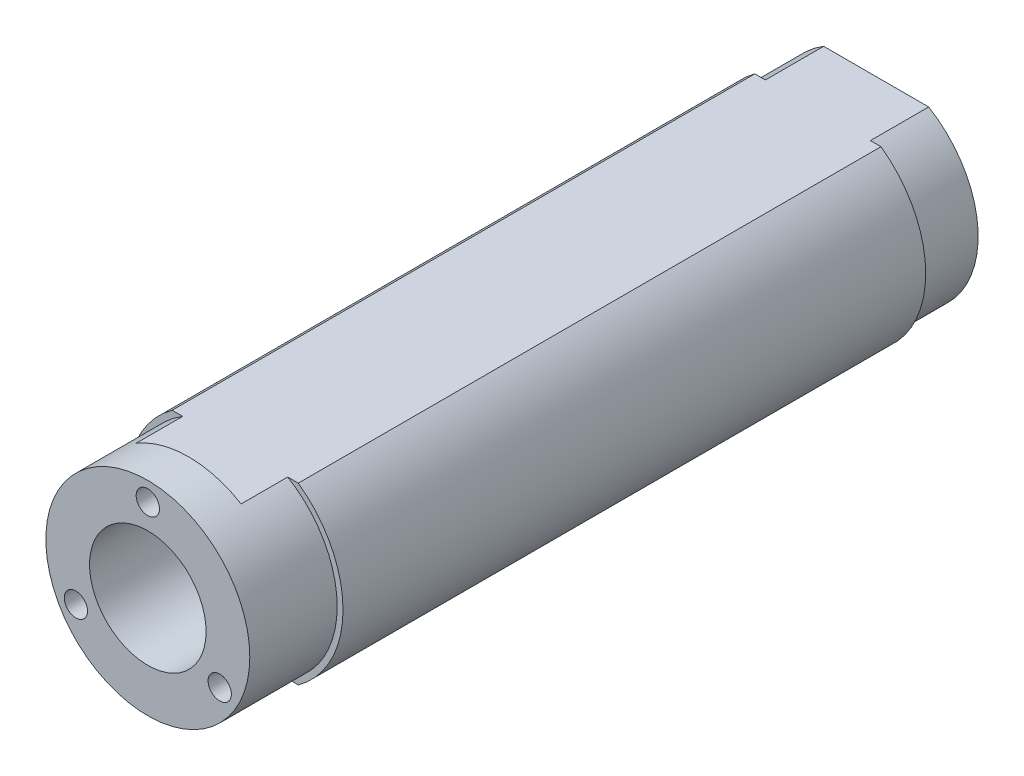
from build123d import *

# Parameters (mm, degrees)
BOSS_EXTRUDE1_DEPTH         = 65
BOSS_EXTRUDE1_DEPTH_BACK    = 60
SKETCH1_R                   = 10
BOSS_EXTRUDE2_DEPTH         = 50
BOSS_EXTRUDE2_DEPTH_BACK    = 50
BOSS_EXTRUDE3_START         = -7
SKETCH5_R                   = 17.5
SKETCH5_R_2                 = 10
BOSS_EXTRUDE3_DEPTH         = 7
SKETCH6_R                   = 2
CUT_EXTRUDE1_DEPTH          = 5
M3_TAPPED_HOLE1_D           = 2.5
M3_TAPPED_HOLE1_DEPTH       = 7.5
M3_TAPPED_HOLE1_CSINK_D     = 3.05
M3_TAPPED_HOLE1_CSINK_ANGLE = 90
M3_TAPPED_HOLE1_TIP         = 0.751075774


with BuildPart() as part:
    # Sketch1 → Boss-Extrude1 (new, two sides: drawn at the far end of the back side and taken through both)
    with BuildSketch(Plane.XY.offset(-BOSS_EXTRUDE1_DEPTH_BACK)):
        with BuildLine():
            Line((9.013878189, 15), (-9.013878189, 15))
            ThreePointArc((-9.013878189, 15), (-17.5, 0), (-9.013878189, -15))
            Line((-9.013878189, -15), (9.013878189, -15))
            ThreePointArc((9.013878189, -15), (17.5, 0), (9.013878189, 15))
        make_face()
        Circle(SKETCH1_R, mode=Mode.SUBTRACT)
    extrude(amount=BOSS_EXTRUDE1_DEPTH + BOSS_EXTRUDE1_DEPTH_BACK)

    # Sketch1<23> → Boss-Extrude2 (add, two sides: drawn at the far end of the back side and taken through both)
    with BuildSketch(Plane.XY.offset(-BOSS_EXTRUDE2_DEPTH_BACK)):
        with BuildLine():
            Line((-9.013878189, 15), (-10.828203914, 15))
            ThreePointArc((-10.828203914, 15), (-18.5, 0), (-10.828203914, -15))
            Line((-10.828203914, -15), (-9.013878189, -15))
            ThreePointArc((-9.013878189, -15), (-17.5, 0), (-9.013878189, 15))
        make_face()
        with BuildLine():
            ThreePointArc((10.828203914, -15), (18.5, 0), (10.828203914, 15))
            Line((10.828203914, 15), (9.013878189, 15))
            ThreePointArc((9.013878189, 15), (17.5, 0), (9.013878189, -15))
            Line((9.013878189, -15), (10.828203914, -15))
        make_face()
    extrude(amount=BOSS_EXTRUDE2_DEPTH + BOSS_EXTRUDE2_DEPTH_BACK)

    # Sketch5 → Boss-Extrude3 (add)
    with BuildSketch(Plane.XY.offset(65).offset(BOSS_EXTRUDE3_START)):
        Circle(SKETCH5_R)
        Circle(SKETCH5_R_2, mode=Mode.SUBTRACT)
    extrude(amount=BOSS_EXTRUDE3_DEPTH)

    # Sketch6 → Cut-Extrude1 (cut)
    with BuildSketch(Plane.XY.offset(65)):
        with Locations((0, 14.25)):
            Circle(SKETCH6_R)
        with Locations((12.340862004, -7.125)):
            Circle(SKETCH6_R)
        with Locations((-12.340862004, -7.125)):
            Circle(SKETCH6_R)
    extrude(amount=-CUT_EXTRUDE1_DEPTH, mode=Mode.SUBTRACT)

    # M3 Tapped Hole1
    with Locations(Plane(origin=(0, -15, 0), x_dir=(-1, 0, 0), z_dir=(0, -1, 0))):
        with Locations((0, 0)):
            CounterSinkHole(M3_TAPPED_HOLE1_D / 2, M3_TAPPED_HOLE1_CSINK_D / 2, depth=M3_TAPPED_HOLE1_DEPTH, counter_sink_angle=M3_TAPPED_HOLE1_CSINK_ANGLE)
            with Locations((0, 0, -(M3_TAPPED_HOLE1_DEPTH + M3_TAPPED_HOLE1_TIP / 2))):  # 118° drill point
                Cone(0, M3_TAPPED_HOLE1_D / 2, M3_TAPPED_HOLE1_TIP, mode=Mode.SUBTRACT)


solid = part.part
